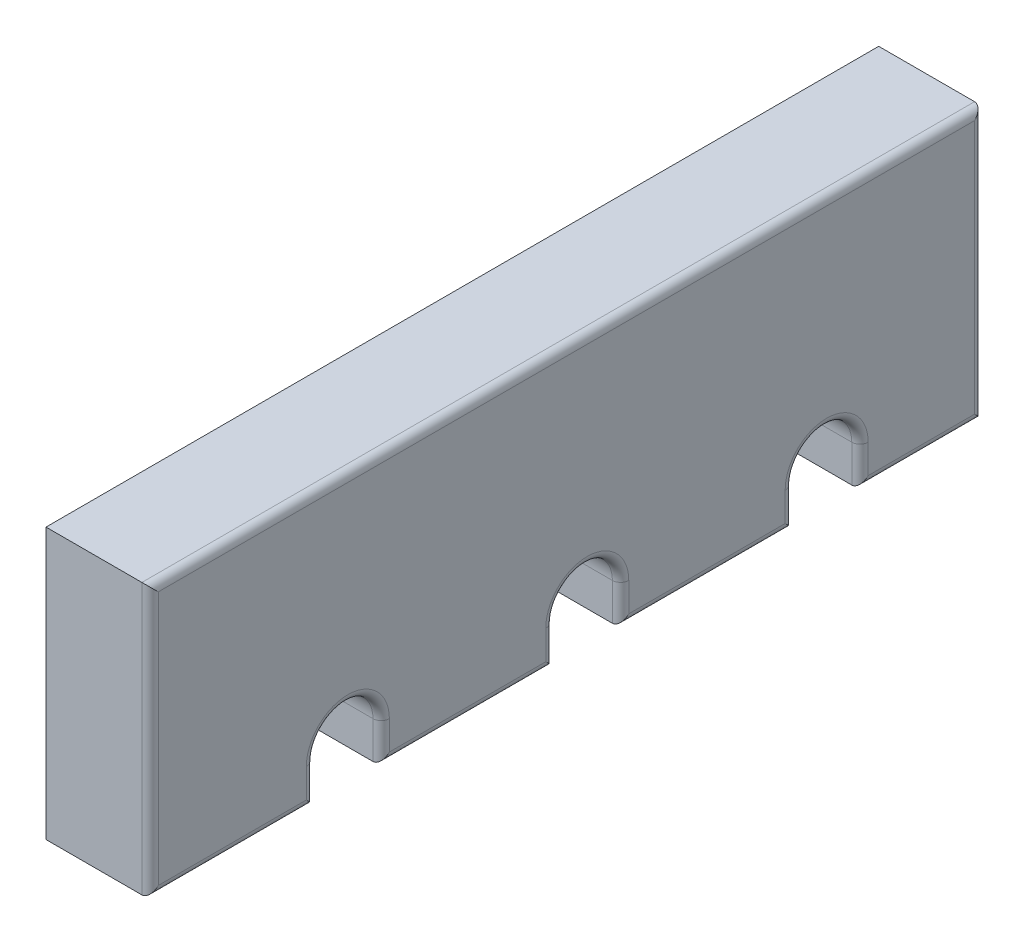
from build123d import *

# Parameters (mm, degrees)
SKETCH1_W           = 508
SKETCH1_H           = 165.1
BOSS_EXTRUDE2_DEPTH = 63.5
CUT_EXTRUDE2_DEPTH  = 275.522772279
SHELL1_T            = -6.35
FILLET1_R           = 5
FILLET2_R           = 3.18


with BuildPart() as part:
    # Sketch1 → Boss-Extrude2 (new body)
    with BuildSketch(Plane(origin=(0, 0, 0), x_dir=(0, 0, -1), z_dir=(1, 0, 0))):
        Rectangle(SKETCH1_W, SKETCH1_H)
    extrude(amount=BOSS_EXTRUDE2_DEPTH)

    # Sketch14 → Cut-Extrude2 (cut, through all)
    with BuildSketch(Plane(origin=(63.5, 0, 0), x_dir=(0, 0, -1), z_dir=(1, 0, 0))):
        with BuildLine():
            Line((-153.67, -82.55), (-153.67, -59.9))
            ThreePointArc((-153.67, -59.9), (-133.35, -39.58), (-113.03, -59.9))
            Line((-113.03, -59.9), (-113.03, -82.55))
            ThreePointArc((-113.03, -82.55), (-133.35, -102.87), (-153.67, -82.55))
        make_face()
        with BuildLine():
            Line((-7.62, -82.55), (-7.62, -59.9))
            ThreePointArc((-7.62, -59.9), (12.7, -39.58), (33.02, -59.9))
            Line((33.02, -59.9), (33.02, -82.55))
            ThreePointArc((33.02, -82.55), (12.7, -102.87), (-7.62, -82.55))
        make_face()
        with BuildLine():
            Line((138.43, -82.55), (138.43, -59.9))
            ThreePointArc((138.43, -59.9), (158.75, -39.58), (179.07, -59.9))
            Line((179.07, -59.9), (179.07, -82.55))
            ThreePointArc((179.07, -82.55), (158.75, -102.87), (138.43, -82.55))
        make_face()
    extrude(amount=-CUT_EXTRUDE2_DEPTH, mode=Mode.SUBTRACT)

    # Shell1
    shell1_openings = [part.faces().sort_by_distance(p)[0] for p in [
        (0, 3.74487295, 0.755170832),
    ]]
    offset(amount=SHELL1_T, openings=shell1_openings, kind=Kind.INTERSECTION)

    # Fillet1
    fillet1_edges = [part.edges().sort_by_distance(p)[0] for p in [
        (63.5, 0, 254),
        (63.5, -82.55, 203.835),
        (63.5, -82.55, 60.325),
        (63.5, -82.55, -85.725),
        (63.5, -82.55, -216.535),
        (63.5, -71.225, 153.67),
        (63.5, -71.225, 113.03),
        (63.5, -39.58, 133.35),
        (63.5, -71.225, 7.62),
        (63.5, -71.225, -33.02),
        (63.5, -39.58, -12.7),
        (63.5, -71.225, -138.43),
        (63.5, -71.225, -179.07),
        (63.5, -39.58, -158.75),
        (63.5, 0, -254),
        (63.5, 82.55, 0),
    ]]
    fillet(fillet1_edges, radius=FILLET1_R)

    # Fillet2
    fillet2_edges = [part.edges().sort_by_distance(p)[0] for p in [
        (57.15, -76.2, 60.325),
        (57.15, -76.2, -85.725),
        (57.15, -76.2, -216.535),
        (57.15, 0, -247.65),
        (57.15, 76.2, 0),
        (57.15, 0, 247.65),
        (57.15, -76.2, 203.835),
        (57.15, -68.05, -132.08),
        (57.15, -33.23, -158.75),
        (57.15, -68.05, -185.42),
        (57.15, -68.05, 13.97),
        (57.15, -33.23, -12.7),
        (57.15, -68.05, -39.37),
        (57.15, -68.05, 160.02),
        (57.15, -33.23, 133.35),
        (57.15, -68.05, 106.68),
    ]]
    fillet(fillet2_edges, radius=FILLET2_R)


solid = part.part
